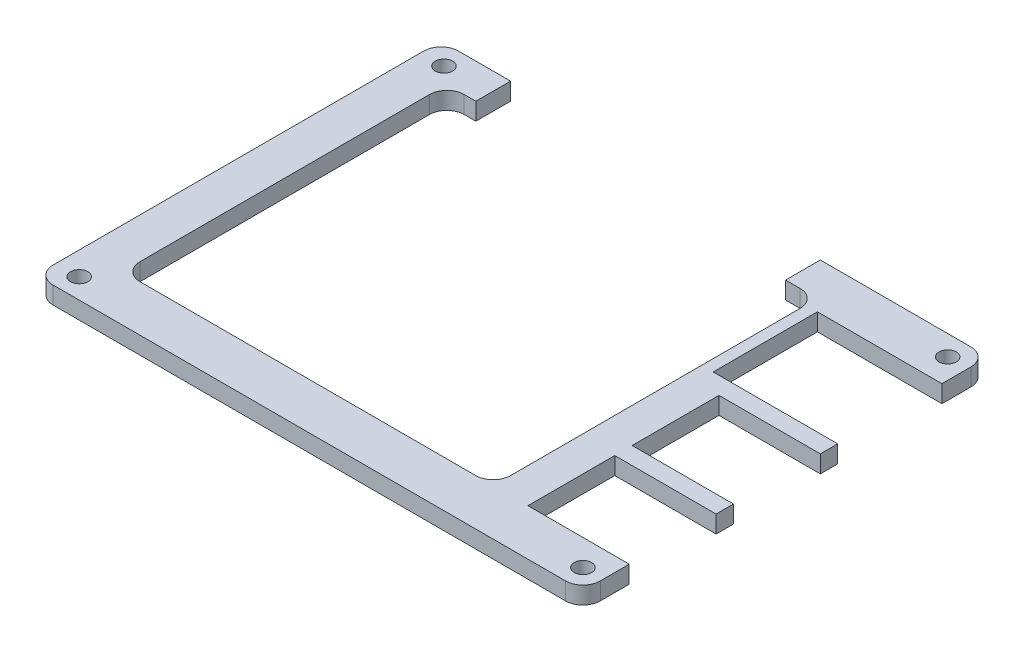
from build123d import *

# Parameters (mm, degrees)
SKETCH1_W           = 94.5
SKETCH1_H           = 70
BOSS_EXTRUDE1_DEPTH = 3
SKETCH3_R           = 1.5
CUT_EXTRUDE2_DEPTH  = 59.877521177
FILLET2_R           = 3
SKETCH5_W           = 64
SKETCH5_H           = 56
SKETCH5_W_2         = 53.5
SKETCH5_H_2         = 6
SKETCH5_W_3         = 21.5
SKETCH5_H_3         = 18
SKETCH5_W_4         = 17.5
SKETCH5_H_4         = 15
CUT_EXTRUDE3_DEPTH  = 59.877521177
FILLET3_R           = 3


with BuildPart() as part:
    # Sketch1 → Boss-Extrude1 (new body)
    with BuildSketch(Plane(origin=(0, 0, 0), x_dir=(1, 0, 0), z_dir=(0, 1, 0))):
        Rectangle(SKETCH1_W, SKETCH1_H)
    extrude(amount=BOSS_EXTRUDE1_DEPTH)

    # Sketch3 → Cut-Extrude2 (cut, through all)
    with BuildSketch(Plane(origin=(0, 3, 0), x_dir=(1, 0, 0), z_dir=(0, 1, 0))):
        with Locations(Location((43.75, 31.5, 0), (0, 0, 270))):
            Circle(SKETCH3_R)
        with Locations(Location((-43.25, 31.5, 0), (0, 0, 270))):
            Circle(SKETCH3_R)
        with Locations(Location((-43.25, -31.5, 0), (0, 0, 270))):
            Circle(SKETCH3_R)
        with Locations(Location((43.75, -31.5, 0), (0, 0, 270))):
            Circle(SKETCH3_R)
    extrude(amount=-CUT_EXTRUDE2_DEPTH, mode=Mode.SUBTRACT)

    # Fillet2
    fillet2_edges = [part.edges().sort_by_distance(p)[0] for p in [
        (47.25, 1.5, 35),
        (-47.25, 1.5, 35),
        (-47.25, 1.5, -35),
        (47.25, 1.5, -35),
    ]]
    fillet(fillet2_edges, radius=FILLET2_R)

    # Sketch5 → Cut-Extrude3 (cut, through all)
    with BuildSketch(Plane(origin=(0, 3, 0), x_dir=(1, 0, 0), z_dir=(0, 1, 0))):
        with Locations((-8.25, 1)):
            Rectangle(SKETCH5_W, SKETCH5_H)
        with Locations((-8.5, 32)):
            Rectangle(SKETCH5_W_2, SKETCH5_H_2)
        with Locations((36.5, 18)):
            Rectangle(SKETCH5_W_3, SKETCH5_H_3)
        with Locations((38.5, -1.5)):
            Rectangle(SKETCH5_W_4, SKETCH5_H_4)
        with Locations((38.5, -19.5)):
            Rectangle(SKETCH5_W_4, SKETCH5_H_4)
    extrude(amount=-CUT_EXTRUDE3_DEPTH, mode=Mode.SUBTRACT)

    # Fillet3
    fillet3_edges = [part.edges().sort_by_distance(p)[0] for p in [
        (-40.25, 1.5, 27),
        (-40.25, 1.5, -29),
        (23.75, 1.5, -29),
        (23.75, 1.5, 27),
    ]]
    fillet(fillet3_edges, radius=FILLET3_R)


solid = part.part
